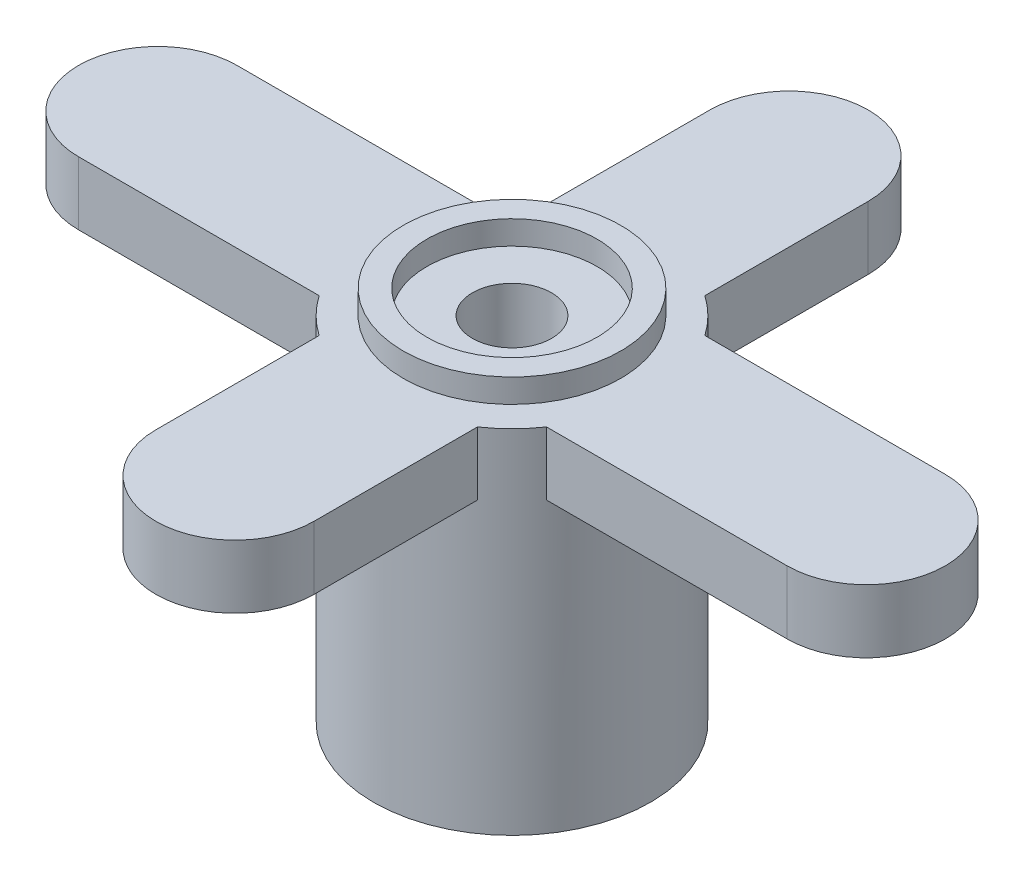
from build123d import *

# Parameters (mm, degrees)
SZKIC1_R                    = 3.5
DODANIE_WYCI_GNI_CIE1_DEPTH = 9.5
SZKIC2_R                    = 1.9
WYTNIJ_WYCI_GNI_CIE1_DEPTH  = 3.5
SZKIC3_R                    = 2
DODANIE_WYCI_GNI_CIE2_DEPTH = 1.6
WYTNIJ_WYCI_GNI_CIE2_START  = -0.6
SZKIC4_R                    = 2.15
WYTNIJ_WYCI_GNI_CIE2_DEPTH  = 0.6
SZKIC5_R                    = 1
WYTNIJ_WYCI_GNI_CIE3_DEPTH  = 31.6
WYTNIJ_WYCI_GNI_CIE4_START  = -0.6
SZKIC6_R                    = 3.5
SZKIC6_R_2                  = 2.75
WYTNIJ_WYCI_GNI_CIE4_DEPTH  = 0.6


with BuildPart() as part:
    # Szkic1 → Dodanie-wyciągnięcie1 (new body)
    with BuildSketch(Plane(origin=(0, 0, 0), x_dir=(1, 0, 0), z_dir=(0, 1, 0))):
        with Locations(Location((0, 0, 0), (0, 0, 270))):
            Circle(SZKIC1_R)
    extrude(amount=DODANIE_WYCI_GNI_CIE1_DEPTH)

    # Szkic2 → Wytnij-wyciągnięcie1 (cut)
    with BuildSketch(Plane.XZ):
        with Locations(Location((0, 0, 0), (0, 0, 270))):
            Circle(SZKIC2_R)
    extrude(amount=-WYTNIJ_WYCI_GNI_CIE1_DEPTH, mode=Mode.SUBTRACT)

    # Szkic3 → Dodanie-wyciągnięcie2 (add)
    with BuildSketch(Plane(origin=(0, 8.9, 0), x_dir=(1, 0, 0), z_dir=(0, 1, 0))):
        with Locations((-8.95, 0)):
            Circle(SZKIC3_R)
        with BuildLine():
            Line((-2, 2), (-8.95, 2))
            ThreePointArc((-8.95, 2), (-7.535786438, 1.414213562), (-6.95, 0))
            ThreePointArc((-6.95, 0), (-7.535786438, -1.414213562), (-8.95, -2))
            Line((-8.95, -2), (-2, -2))
            Line((-2, -2), (-2, 2))
        make_face()
        with Locations((0, 7)):
            Circle(SZKIC3_R)
        with BuildLine():
            Line((-2, 7), (-2, 2))
            Line((-2, 2), (0, 2))
            Line((0, 2), (2, 2))
            Line((2, 2), (2, 7))
            ThreePointArc((2, 7), (0, 5), (-2, 7))
        make_face()
        with BuildLine():
            Line((8.95, 2), (2, 2))
            Line((2, 2), (2, 0))
            Line((2, 0), (2, -2))
            Line((2, -2), (8.95, -2))
            ThreePointArc((8.95, -2), (6.95, 0), (8.95, 2))
        make_face()
        with Locations((8.95, 0)):
            Circle(SZKIC3_R)
        with Locations((0, -7)):
            Circle(SZKIC3_R)
        with BuildLine():
            Line((2, -2), (-2, -2))
            Line((-2, -2), (-2, -7))
            ThreePointArc((-2, -7), (0, -5), (2, -7))
            Line((2, -7), (2, -2))
        make_face()
    extrude(amount=-DODANIE_WYCI_GNI_CIE2_DEPTH)

    # Szkic4 → Wytnij-wyciągnięcie2 (cut)
    with BuildSketch(Plane(origin=(0, 9.5, 0), x_dir=(1, 0, 0), z_dir=(0, 1, 0)).offset(WYTNIJ_WYCI_GNI_CIE2_START)):
        with Locations(Location((0, 0, 0), (0, 0, 270))):
            Circle(SZKIC4_R)
    extrude(amount=WYTNIJ_WYCI_GNI_CIE2_DEPTH, mode=Mode.SUBTRACT)

    # Szkic5 → Wytnij-wyciągnięcie3 (cut)
    with BuildSketch(Plane(origin=(0, 8.9, 0), x_dir=(1, 0, 0), z_dir=(0, 1, 0))):
        with Locations(Location((0, 0, 0), (0, 0, 270))):
            Circle(SZKIC5_R)
    extrude(amount=-WYTNIJ_WYCI_GNI_CIE3_DEPTH, mode=Mode.SUBTRACT)

    # Szkic6 → Wytnij-wyciągnięcie4 (cut)
    with BuildSketch(Plane(origin=(0, 9.5, 0), x_dir=(1, 0, 0), z_dir=(0, 1, 0)).offset(WYTNIJ_WYCI_GNI_CIE4_START)):
        with Locations(Location((0, 0, 0), (0, 0, 124.849904579))):
            Circle(SZKIC6_R)
        with Locations(Location((0, 0, 0), (0, 0, 270))):
            Circle(SZKIC6_R_2, mode=Mode.SUBTRACT)
    extrude(amount=WYTNIJ_WYCI_GNI_CIE4_DEPTH, mode=Mode.SUBTRACT)


solid = part.part
